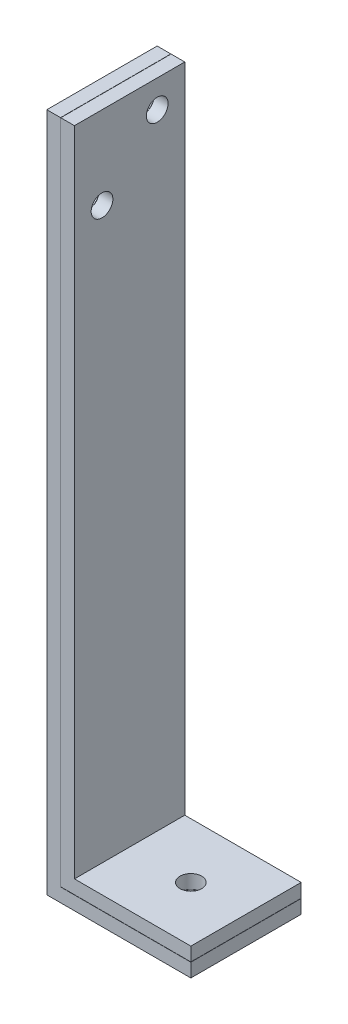
from build123d import *

# Parameters (mm, degrees)
SALIENTE_EXTRUIR1_DEPTH = 50.8
SALIENTE_EXTRUIR2_DEPTH = 50.8
CROQUIS5_R              = 5
CORTAR_EXTRUIR2_DEPTH   = 24.525
CROQUIS3_R              = 5
CORTAR_EXTRUIR3_DEPTH   = 29


with BuildPart() as part:
    # Croquis1 → Saliente-Extruir1 (new body)
    with BuildSketch(Plane.XY):
        Polygon((0, 0), (66.31, 0), (66.31, 6.31), (6.31, 6.31), (6.31, 313.04), (0, 313.04), align=None)
    extrude(amount=SALIENTE_EXTRUIR1_DEPTH)


with BuildPart() as body_2:
    # Croquis2 → Saliente-Extruir2 (new body)
    with BuildSketch(Plane.XY.offset(50.8)):
        Polygon((6.41, 313.04), (12.72, 313.04), (12.72, 12.72), (66.31, 12.72), (66.31, 6.41), (6.41, 6.41), align=None)
    extrude(amount=-SALIENTE_EXTRUIR2_DEPTH)


with BuildPart() as cortar_extruir2_tool:
    # Croquis5 → Cortar-Extruir2 (new body)
    with BuildSketch(Plane(origin=(0, 12.72, 0), x_dir=(1, 0, 0), z_dir=(0, 1, 0))):
        with Locations(Location((40.91, -25.4, 0), (0, 0, 180))):
            Circle(CROQUIS5_R)
    extrude(amount=-CORTAR_EXTRUIR2_DEPTH)


with BuildPart() as part_1:
    add(part.part)

    # Cortar-Extruir2: cut by cortar_extruir2_tool
    add(cortar_extruir2_tool.part, mode=Mode.SUBTRACT)


with BuildPart() as body_2_1:
    add(body_2.part)

    # Cortar-Extruir2: cut by cortar_extruir2_tool
    add(cortar_extruir2_tool.part, mode=Mode.SUBTRACT)


with BuildPart() as cortar_extruir3_tool:
    # Croquis3 → Cortar-Extruir3 (new body)
    with BuildSketch(Plane.ZY):
        with Locations(Location((38.1, 274.94, 0), (0, 0, 90))):
            Circle(CROQUIS3_R)
        with Locations(Location((12.7, 300.34, 0), (0, 0, 90))):
            Circle(CROQUIS3_R)
    extrude(amount=-CORTAR_EXTRUIR3_DEPTH)


with BuildPart() as part_2:
    add(part_1.part)

    # Cortar-Extruir3: cut by cortar_extruir3_tool
    add(cortar_extruir3_tool.part, mode=Mode.SUBTRACT)


with BuildPart() as body_2_2:
    add(body_2_1.part)

    # Cortar-Extruir3: cut by cortar_extruir3_tool
    add(cortar_extruir3_tool.part, mode=Mode.SUBTRACT)


solid = Compound([part_2.part, body_2_2.part])
